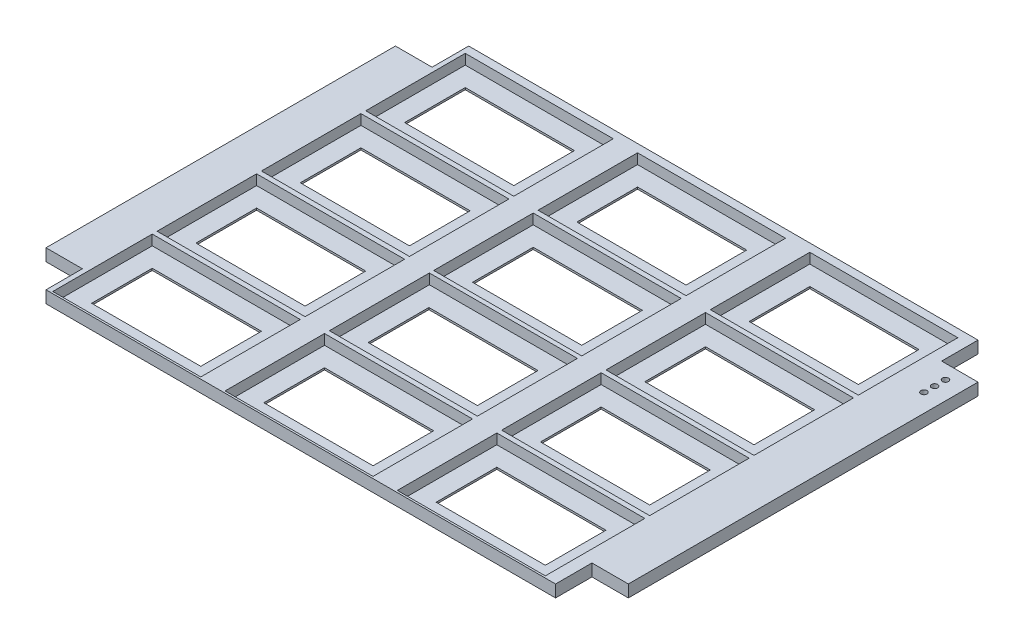
from build123d import *

# Parameters (mm, degrees)
SKETCH1_W           = 77.47
SKETCH1_H           = 52.07
SKETCH1_R           = 1.5875
SKETCH1_H_2         = 52.34
BOSS_EXTRUDE3_DEPTH = 6.35
SKETCH2_W           = 19.05
SKETCH2_H           = 1
CUT_EXTRUDE1_DEPTH  = 193.995155978
SKETCH4_W           = 19.05
SKETCH4_H           = 1
CUT_EXTRUDE2_DEPTH  = 193.995155978
SKETCH5_W           = 257.81
SKETCH5_H           = 1
BOSS_EXTRUDE4_DEPTH = 215.9
SKETCH6_W           = 57.15
SKETCH6_H           = 31.75
CUT_EXTRUDE3_DEPTH  = 193.964841955


with BuildPart() as part:
    # Sketch1 → Boss-Extrude3 (new body)
    with BuildSketch(Plane(origin=(0, 0, 0), x_dir=(1, 0, 0), z_dir=(0, 1, 0))):
        Polygon((148.59, 94.11025641), (129.54, 94.11025641), (129.54, 113.16025641), (-137.02974359, 113.16025641), (-137.02974359, 93.98), (-156.21, 93.98), (-156.21, -88.9), (-137.16, -88.9), (-137.16, -106.95), (-156.21, -106.95), (-156.21, -107.95), (148.59, -107.95), (148.59, -106.95), (129.54, -106.95), (129.54, -88.9), (148.59, -88.9), align=None)
        with Locations((-95.885, -80.915)):
            Rectangle(SKETCH1_W, SKETCH1_H, mode=Mode.SUBTRACT)
        with Locations((-5.715, -80.915)):
            Rectangle(SKETCH1_W, SKETCH1_H, mode=Mode.SUBTRACT)
        with Locations((84.455, -80.915)):
            Rectangle(SKETCH1_W, SKETCH1_H, mode=Mode.SUBTRACT)
        with Locations((84.455, 82.915)):
            Rectangle(SKETCH1_W, SKETCH1_H, mode=Mode.SUBTRACT)
        with Locations((84.455, 28.305)):
            Rectangle(SKETCH1_W, SKETCH1_H, mode=Mode.SUBTRACT)
        with Locations((84.455, -26.305)):
            Rectangle(SKETCH1_W, SKETCH1_H, mode=Mode.SUBTRACT)
        with Locations(Location((139.065, 75.334869264, 0), (0, 0, 270))):
            Circle(SKETCH1_R, mode=Mode.SUBTRACT)
        with Locations(Location((139.065, 80.910552749, 0), (0, 0, 270))):
            Circle(SKETCH1_R, mode=Mode.SUBTRACT)
        with Locations(Location((139.065, 86.618990604, 0), (0, 0, 270))):
            Circle(SKETCH1_R, mode=Mode.SUBTRACT)
        with Locations((-5.715, 82.915)):
            Rectangle(SKETCH1_W, SKETCH1_H, mode=Mode.SUBTRACT)
        with Locations((-95.885, -26.305)):
            Rectangle(SKETCH1_W, SKETCH1_H, mode=Mode.SUBTRACT)
        with Locations((-5.715, -26.17)):
            Rectangle(SKETCH1_W, SKETCH1_H_2, mode=Mode.SUBTRACT)
        with Locations((-95.885, 28.305)):
            Rectangle(SKETCH1_W, SKETCH1_H, mode=Mode.SUBTRACT)
        with Locations((-5.715, 28.305)):
            Rectangle(SKETCH1_W, SKETCH1_H, mode=Mode.SUBTRACT)
        with Locations((-95.885, 82.915)):
            Rectangle(SKETCH1_W, SKETCH1_H, mode=Mode.SUBTRACT)
    extrude(amount=BOSS_EXTRUDE3_DEPTH)

    # Sketch2 → Cut-Extrude1 (cut, through all)
    with BuildSketch(Plane(origin=(0, 6.35, 0), x_dir=(1, 0, 0), z_dir=(0, 1, 0))):
        with Locations((139.065, -107.45)):
            Rectangle(SKETCH2_W, SKETCH2_H)
    extrude(amount=-CUT_EXTRUDE1_DEPTH, mode=Mode.SUBTRACT)

    # Sketch4 → Cut-Extrude2 (cut, through all)
    with BuildSketch(Plane(origin=(0, 6.35, 0), x_dir=(1, 0, 0), z_dir=(0, 1, 0))):
        with Locations((-146.685, -107.45)):
            Rectangle(SKETCH4_W, SKETCH4_H)
    extrude(amount=-CUT_EXTRUDE2_DEPTH, mode=Mode.SUBTRACT)

    # Sketch5 → Boss-Extrude4 (add)
    with BuildSketch(Plane.XY.offset(-108.95)):
        with Locations((-5.715, 0.5)):
            Rectangle(SKETCH5_W, SKETCH5_H)
    extrude(amount=BOSS_EXTRUDE4_DEPTH)

    # Sketch6 → Cut-Extrude3 (cut, through all)
    with BuildSketch(Plane(origin=(0, 1, 0), x_dir=(1, 0, 0), z_dir=(0, 1, 0))):
        with Locations((-95.885, 82.915)):
            Rectangle(SKETCH6_W, SKETCH6_H)
        with Locations((-95.885, 28.305)):
            Rectangle(SKETCH6_W, SKETCH6_H)
        with Locations((-95.885, -26.305)):
            Rectangle(SKETCH6_W, SKETCH6_H)
        with Locations((-95.885, -80.915)):
            Rectangle(SKETCH6_W, SKETCH6_H)
        with Locations((-5.715, 82.915)):
            Rectangle(SKETCH6_W, SKETCH6_H)
        with Locations((84.455, 82.915)):
            Rectangle(SKETCH6_W, SKETCH6_H)
        with Locations((-5.715, 28.305)):
            Rectangle(SKETCH6_W, SKETCH6_H)
        with Locations((-5.715, -26.305)):
            Rectangle(SKETCH6_W, SKETCH6_H)
        with Locations((-5.715, -80.915)):
            Rectangle(SKETCH6_W, SKETCH6_H)
        with Locations((84.455, -80.915)):
            Rectangle(SKETCH6_W, SKETCH6_H)
        with Locations((84.455, -26.305)):
            Rectangle(SKETCH6_W, SKETCH6_H)
        with Locations((84.455, 28.305)):
            Rectangle(SKETCH6_W, SKETCH6_H)
    extrude(amount=-CUT_EXTRUDE3_DEPTH, mode=Mode.SUBTRACT)


solid = part.part
